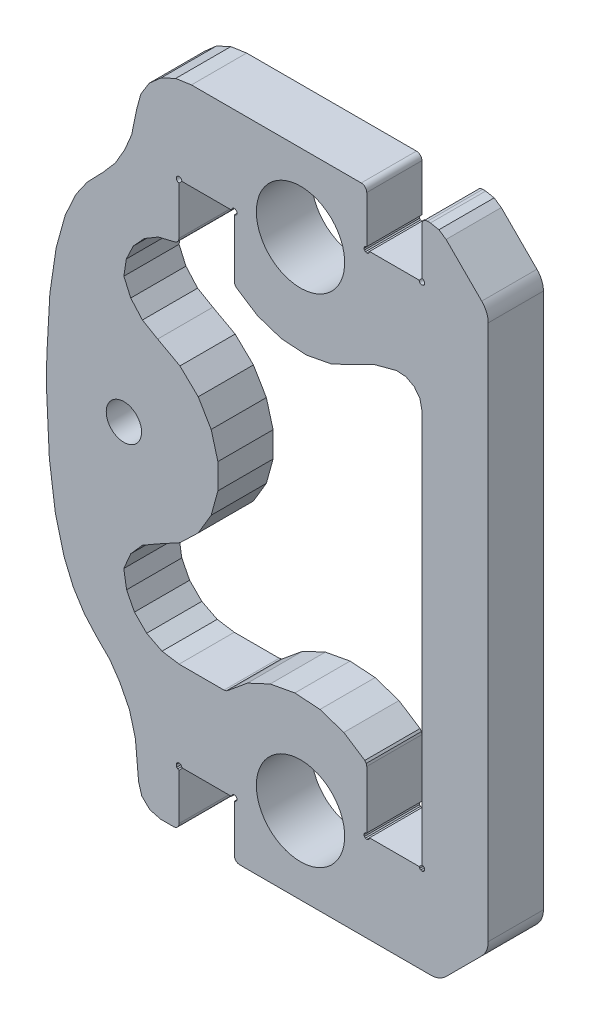
from build123d import *

# Parameters (mm, degrees)
ESQUISSE1_R        = 4
ESQUISSE1_R_2      = 1.59999944
BOSS_EXTRU_1_DEPTH = 5


with BuildPart() as part:
    # Esquisse1 → Boss.-Extru.1 (new body)
    with BuildSketch(Plane(origin=(0, 0, 0), x_dir=(-1, 0, 0), z_dir=(0, 0, -1))):
        with BuildLine():
            Line((-8.039665, 5.193958), (-7.511682, 7.163724))
            Line((-7.511682, 7.163724), (-6.637512, 8.89434))
            Line((-6.637512, 8.89434), (-5.734358, 10.21466))
            Line((-5.734358, 10.21466), (-4.529502, 11.42329))
            Line((-4.529502, 11.42329), (-3.426544, 12.65958))
            Line((-3.426544, 12.65958), (-2.422703, 14.23997))
            Line((-2.422703, 14.23997), (-1.578115, 16.23473))
            Line((-1.578115, 16.23473), (-0.7880442, 19.27814))
            Line((-0.7880442, 19.27814), (-0.2469295, 23.26466))
            Line((-0.2469295, 23.26466), (-0.008147676, 28.26909))
            Line((-0.008147676, 28.26909), (0, 29.5))
            Line((0, 29.5), (-0.01509115, 31.16446))
            Line((-0.01509115, 31.16446), (-0.2937396, 36.23574))
            Line((-0.2937396, 36.23574), (-0.8642389, 40.10257))
            Line((-0.8642389, 40.10257), (-1.681502, 43.05889))
            Line((-1.681502, 43.05889), (-2.667923, 45.20577))
            Line((-2.667923, 45.20577), (-3.68381, 46.66188))
            Line((-3.68381, 46.66188), (-5.121313, 48.15284))
            Line((-5.121313, 48.15284), (-6.221777, 49.42276))
            Line((-6.221777, 49.42276), (-7.084233, 50.913))
            Line((-7.084233, 50.913), (-7.705722, 52.38649))
            Line((-7.705722, 52.38649), (-8.155009, 54.60259))
            Line((-8.155009, 54.60259), (-8.534575, 55.99675))
            Line((-8.534575, 55.99675), (-9.29695, 57.22417))
            Line((-9.29695, 57.22417), (-10.37847, 58.18233))
            Line((-10.37847, 58.18233), (-11.68882, 58.79123))
            Line((-11.68882, 58.79123), (-13.11856, 59))
            Line((-13.11856, 59), (-28.5, 59))
            ThreePointArc((-28.5, 59), (-28.853553391, 58.853553391), (-29, 58.5))
            Line((-29, 58.5), (-29, 54.25))
            Line((-29, 54.25), (-28.875, 54.2165))
            Line((-28.875, 54.2165), (-28.78349, 54.125))
            Line((-28.78349, 54.125), (-28.75, 54))
            Line((-28.75, 54), (-28.78349, 53.875))
            Line((-28.78349, 53.875), (-28.875, 53.78349))
            Line((-28.875, 53.78349), (-29, 53.75))
            Line((-29, 53.75), (-29.125, 53.78349))
            Line((-29.125, 53.78349), (-29.21651, 53.875))
            Line((-29.21651, 53.875), (-29.25, 54))
            Line((-29.25, 54), (-33.75, 54))
            ThreePointArc((-33.75, 54), (-34.176776695, 53.823223305), (-34, 54.25))
            Line((-34, 54.25), (-34, 58.5))
            ThreePointArc((-34, 58.5), (-34.146446609, 58.853553391), (-34.5, 59))
            Line((-34.5, 59), (-34.77157, 59))
            Line((-34.77157, 59), (-35.53694, 58.84776))
            Line((-35.53694, 58.84776), (-36.18579, 58.41422))
            Line((-36.18579, 58.41422), (-39.41421372, 55.18578628))
            ThreePointArc((-39.41421372, 55.18578628), (-39.847759129, 54.53693809), (-40, 53.77157))
            Line((-40, 53.77157), (-40, 5.228428))
            ThreePointArc((-40, 5.228428), (-39.847759811, 4.463063957), (-39.414216379, 3.814219379))
            Line((-39.414216379, 3.814219379), (-36.18579, 0.585787))
            ThreePointArc((-36.18579, 0.585787), (-35.536943679, 0.152241095), (-34.771576938, 0))
            Line((-34.771576938, 0), (-17.5, 0))
            ThreePointArc((-17.5, 0), (-17.146446609, 0.146446609), (-17, 0.5))
            Line((-17, 0.5), (-17, 4.75))
            Line((-17, 4.75), (-17.125, 4.783494))
            Line((-17.125, 4.783494), (-17.21651, 4.875))
            Line((-17.21651, 4.875), (-17.25, 5.000001))
            Line((-17.25, 5.000001), (-17.21651, 5.125001))
            Line((-17.21651, 5.125001), (-17.125, 5.216507))
            Line((-17.125, 5.216507), (-17, 5.25))
            Line((-17, 5.25), (-16.875, 5.216507))
            Line((-16.875, 5.216507), (-16.78349, 5.125001))
            Line((-16.78349, 5.125001), (-16.75, 5.000001))
            Line((-16.75, 5.000001), (-12.25, 5.000001))
            Line((-12.25, 5.000001), (-12.21651, 5.125001))
            Line((-12.21651, 5.125001), (-12.125, 5.216507))
            Line((-12.125, 5.216507), (-12, 5.25))
            Line((-12, 5.25), (-11.875, 5.216507))
            Line((-11.875, 5.216507), (-11.78349, 5.125001))
            Line((-11.78349, 5.125001), (-11.75, 5.000001))
            Line((-11.75, 5.000001), (-11.78349, 4.810393211))
            Line((-11.78349, 4.810393211), (-11.875, 4.718887211))
            Line((-11.875, 4.718887211), (-12, 4.685393211))
            Line((-12, 4.685393211), (-12, 0.500001))
            ThreePointArc((-12, 0.500001), (-11.853553098, 0.146446902), (-11.499999, 0))
            Line((-11.499999, 0), (-10.33203, 0))
            Line((-10.33203, 0), (-9.352249, 0.2564304))
            Line((-9.352249, 0.2564304), (-8.623715, 0.9599663))
            Line((-8.623715, 0.9599663), (-8.333246, 1.9302))
            Line((-8.333246, 1.9302), (-8.039665, 5.193958))
        make_face()
        with Locations((-23, 52)):
            Circle(ESQUISSE1_R, mode=Mode.SUBTRACT)
        with Locations((-23, 6.999999)):
            Circle(ESQUISSE1_R, mode=Mode.SUBTRACT)
        with Locations((-7, 29.499999)):
            Circle(ESQUISSE1_R_2, mode=Mode.SUBTRACT)
        with BuildLine():
            Line((-27.85382, 44.42105), (-25.78795, 43.4427))
            Line((-25.78795, 43.4427), (-23.54223, 43.01635))
            Line((-23.54223, 43.01635), (-21.26154, 43.1695))
            Line((-21.26154, 43.1695), (-19.09299, 43.89227))
            Line((-19.09299, 43.89227), (-17.17647, 45.13804))
            Line((-17.17647, 45.13804), (-17.04626, 45.30922))
            Line((-17.04626, 45.30922), (-17, 45.51926))
            Line((-17, 45.51926), (-17, 50.75))
            ThreePointArc((-17, 50.75), (-17.176776695, 51.176776695), (-16.75, 51))
            Line((-16.75, 51), (-12.25, 51))
            ThreePointArc((-12.25, 51), (-11.823223305, 51.176776695), (-12, 50.75))
            Line((-12, 50.75), (-12, 46.412623211))
            Line((-12, 46.412623211), (-11.9404, 46.175873211))
            Line((-11.9404, 46.175873211), (-11.7758, 45.995563211))
            Line((-11.7758, 45.995563211), (-11.54545, 45.914693211))
            Line((-11.54545, 45.914693211), (-10.113, 45.565643211))
            Line((-10.113, 45.565643211), (-8.844621, 44.813993211))
            Line((-8.844621, 44.813993211), (-7.850602, 43.725103211))
            Line((-7.850602, 43.725103211), (-7.217376, 42.393653211))
            Line((-7.217376, 42.393653211), (-7, 40.935393211))
            Line((-7, 40.935393211), (-7.619118173, 39.531113076))
            Line((-7.619118173, 39.531113076), (-8.678014173, 38.335053076))
            Line((-8.678014173, 38.335053076), (-10.060093173, 37.534003076))
            Line((-10.060093173, 37.534003076), (-12.077863173, 36.434693076))
            Line((-12.077863173, 36.434693076), (-13.732523173, 34.840353076))
            Line((-13.732523173, 34.840353076), (-14.905963173, 32.864763076))
            Line((-14.905963173, 32.864763076), (-15.514393173, 30.648993076))
            Line((-15.514393173, 30.648993076), (-15.514393173, 28.351193076))
            Line((-15.514393173, 28.351193076), (-14.905963173, 26.135413076))
            Line((-14.905963173, 26.135413076), (-13.732523173, 24.159833076))
            Line((-13.732523173, 24.159833076), (-12.077863173, 22.565493076))
            Line((-12.077863173, 22.565493076), (-10.060093173, 21.466183076))
            Line((-10.060093173, 21.466183076), (-8.678014173, 20.665133076))
            Line((-8.678014173, 20.665133076), (-7.619118173, 19.469073076))
            Line((-7.619118173, 19.469073076), (-6.991483173, 18.000093076))
            Line((-6.991483173, 18.000093076), (-7.244718, 16.45492))
            Line((-7.244718, 16.45492), (-7.954915, 15.06107))
            Line((-7.954915, 15.06107), (-9.061074, 13.95492))
            Line((-9.061074, 13.95492), (-10.45492, 13.24472))
            Line((-10.45492, 13.24472), (-12, 13))
            Line((-12, 13), (-16.0718, 13))
            Line((-16.0718, 13), (-16.27048, 13.04117))
            Line((-16.27048, 13.04117), (-16.43644, 13.1579))
            Line((-16.43644, 13.1579), (-18.19056, 14.60719))
            Line((-18.19056, 14.60719), (-20.2521, 15.57024))
            Line((-20.2521, 15.57024), (-22.48927, 15.9855))
            Line((-22.48927, 15.9855), (-24.7591, 15.82641))
            Line((-24.7591, 15.82641), (-26.91648, 15.10316))
            Line((-26.91648, 15.10316), (-28.82353, 13.86196))
            Line((-28.82353, 13.86196), (-28.95374, 13.69078))
            Line((-28.95374, 13.69078), (-29, 13.48074))
            Line((-29, 13.48074), (-29, 8.25))
            Line((-29, 8.25), (-28.875, 8.216506))
            Line((-28.875, 8.216506), (-28.78349, 8.125))
            Line((-28.78349, 8.125), (-28.75, 8))
            Line((-28.75, 8), (-28.78349, 7.875001))
            Line((-28.78349, 7.875001), (-28.875, 7.783493))
            Line((-28.875, 7.783493), (-29, 7.750001))
            Line((-29, 7.750001), (-29.125, 7.783493))
            Line((-29.125, 7.783493), (-29.21651, 7.875001))
            Line((-29.21651, 7.875001), (-29.25, 8))
            Line((-29.25, 8), (-33.75, 8))
            Line((-33.75, 8), (-33.7835, 7.875001))
            Line((-33.7835, 7.875001), (-33.875, 7.783493))
            Line((-33.875, 7.783493), (-34, 7.750001))
            Line((-34, 7.750001), (-34.125, 7.783493))
            Line((-34.125, 7.783493), (-34.21651, 7.875001))
            Line((-34.21651, 7.875001), (-34.25, 8))
            Line((-34.25, 8), (-34.21651, 8.125))
            Line((-34.21651, 8.125), (-34.125, 8.216506))
            Line((-34.125, 8.216506), (-34, 8.25))
            Line((-34, 8.25), (-34, 43.90222))
            Line((-34, 43.90222), (-33.81641, 44.73928))
            Line((-33.81641, 44.73928), (-33.29933, 45.42266))
            Line((-33.29933, 45.42266), (-32.54371, 45.8269))
            Line((-32.54371, 45.8269), (-31.68826, 45.87778))
            Line((-31.68826, 45.87778), (-29.69555, 45.34813))
            Line((-29.69555, 45.34813), (-27.85382, 44.42105))
        make_face(mode=Mode.SUBTRACT)
    extrude(amount=-BOSS_EXTRU_1_DEPTH)


solid = part.part
